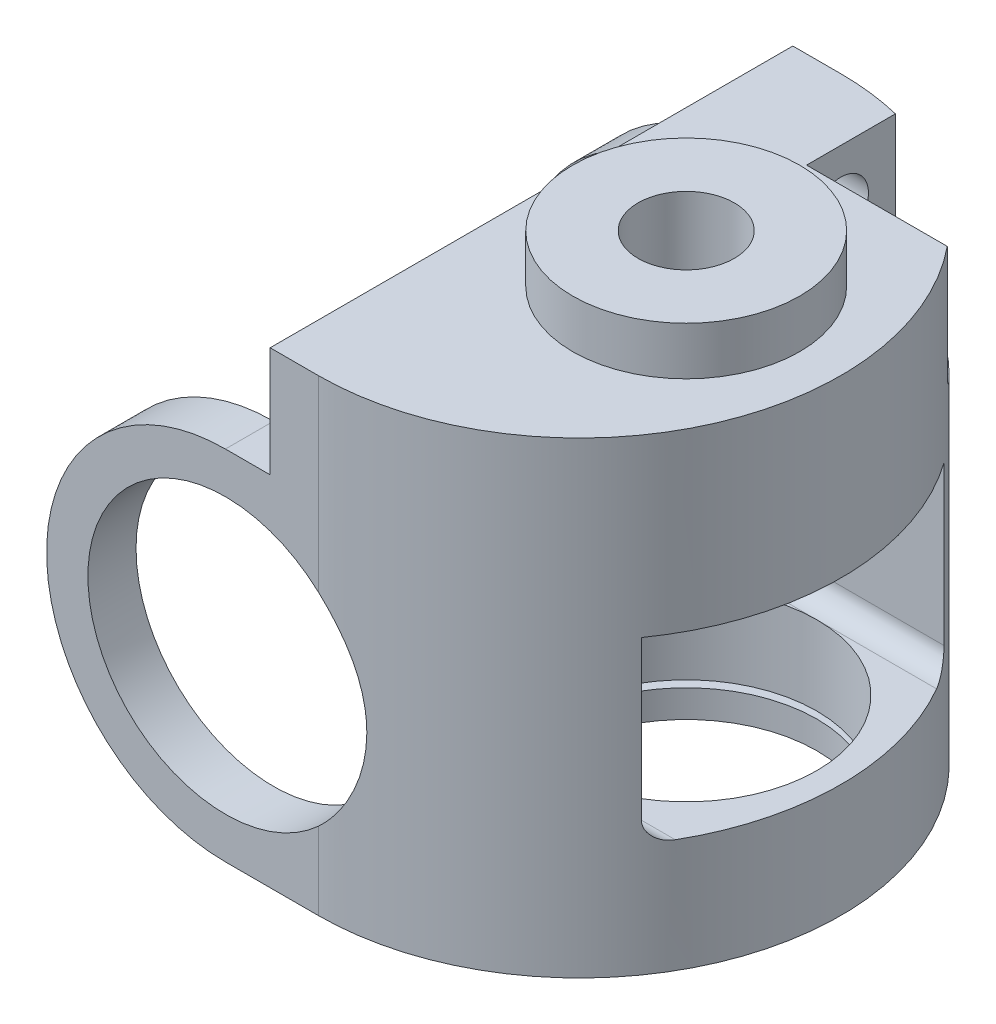
from build123d import *

# Parameters (mm, degrees)
SKETCH2_R               = 3.5
BOSS_EXTRUDE1_DEPTH     = 34
SKETCH19_R              = 8.25
SKETCH19_R_2            = 3.5
BOSS_EXTRUDE3_DEPTH     = 3.5
BOSS_EXTRUDE2_DEPTH     = 3.5
SKETCH4_R               = 10
CUT_EXTRUDE1_DEPTH      = 3.5
LPATTERN4_COUNT         = 2
LPATTERN4_PITCH         = 34.5
CUT_EXTRUDE3_DEPTH      = 48.681233293
SKETCH7_R               = 13.5
CUT_EXTRUDE4_DEPTH      = 4.5
LPATTERN3_COUNT         = 2
LPATTERN3_PITCH         = 26.5
M2_TAPPED_HOLE1_D       = 1.6
M2_TAPPED_HOLE1_DEPTH   = 5.5
M2_TAPPED_HOLE1_TIP     = 0.480688495
SKETCH17_R              = 2
CUT_EXTRUDE5_DEPTH      = 8
CUT_EXTRUDE6_REACH      = 50.532
CUT_EXTRUDE6_END_RADIUS = 19
SKETCH20_R              = 9.75
CUT_EXTRUDE7_DEPTH      = 6.25
SKETCH21_R              = 8.5
CUT_EXTRUDE8_DEPTH      = 0.5
SKETCH22_R              = 9.5
CUT_EXTRUDE9_DEPTH      = 5.75
SKETCH23_R              = 10.5
CUT_EXTRUDE10_DEPTH     = 0.5
SKETCH24_R              = 9.5
CUT_EXTRUDE11_DEPTH     = 2


with BuildPart() as part:
    # Sketch2 → Boss-Extrude1 (new body)
    with BuildSketch(Plane(origin=(0, 0, 0), x_dir=(1, 0, 0), z_dir=(0, 1, 0))):
        with BuildLine():
            Line((-3.5, -19), (-3.5, 19))
            Line((-3.5, 19), (0, 19))
            ThreePointArc((0, 19), (19, 0), (0, -19))
            Line((0, -19), (-3.5, -19))
        make_face()
        with Locations(Location((7.75, 0, 0), (0, 0, 270))):
            Circle(SKETCH2_R, mode=Mode.SUBTRACT)
    extrude(amount=BOSS_EXTRUDE1_DEPTH)

    # Sketch19 → Boss-Extrude3 (add)
    with BuildSketch(Plane(origin=(0, 34, 0), x_dir=(1, 0, 0), z_dir=(0, 1, 0))):
        with Locations(Location((7.75, 0, 0), (0, 0, 270))):
            Circle(SKETCH19_R)
        with Locations(Location((7.75, 0, 0), (0, 0, 270))):
            Circle(SKETCH19_R_2, mode=Mode.SUBTRACT)
    extrude(amount=BOSS_EXTRUDE3_DEPTH)

    # Sketch3 → Boss-Extrude2 (add)
    with BuildSketch(Plane.XY.offset(19)):
        with BuildLine():
            Line((-6.75, 0), (-3.5, 0))
            Line((-3.5, 0), (-3.5, 26))
            Line((-3.5, 26), (-6.75, 26))
            ThreePointArc((-6.75, 26), (-19.75, 13), (-6.75, 0))
        make_face()
    boss_extrude2 = extrude(amount=-BOSS_EXTRUDE2_DEPTH)

    # Sketch4 → Cut-Extrude1 (cut)
    with BuildSketch(Plane.XY.offset(19)):
        with Locations(Location((-6.75, 13, 0), (0, 0, 312.454150204))):
            Circle(SKETCH4_R)
    cut_extrude1 = extrude(amount=-CUT_EXTRUDE1_DEPTH, mode=Mode.SUBTRACT)

    # LPattern4: Boss-Extrude2, Cut-Extrude1 ×2
    with Locations(*[(0, 0, -i * LPATTERN4_PITCH) for i in range(1, LPATTERN4_COUNT)]):
        add(boss_extrude2)
        add(cut_extrude1, mode=Mode.SUBTRACT)

    # Sketch6 → Cut-Extrude3 (cut, through all)
    with BuildSketch(Plane(origin=(-3.5, 0, 0), x_dir=(0, 0, -1), z_dir=(1, 0, 0))):
        with BuildLine():
            Line((11, 21.25), (-11, 21.25))
            Line((-11, 21.25), (-11, 9.75))
            ThreePointArc((-11, 9.75), (-10.560660172, 8.689339828), (-9.5, 8.25))
            Line((-9.5, 8.25), (9.5, 8.25))
            ThreePointArc((9.5, 8.25), (10.560660172, 8.689339828), (11, 9.75))
            Line((11, 9.75), (11, 21.25))
        make_face()
    extrude(amount=CUT_EXTRUDE3_DEPTH, mode=Mode.SUBTRACT)

    # Sketch7 → Cut-Extrude4 (cut)
    with BuildSketch(Plane(origin=(0, 0, 15.5), x_dir=(-1, 0, 0), z_dir=(0, 0, -1))):
        with Locations((6.75, 13)):
            Circle(SKETCH7_R)
    cut_extrude4 = extrude(amount=CUT_EXTRUDE4_DEPTH, mode=Mode.SUBTRACT)

    # LPattern3: Cut-Extrude4 ×2
    with Locations(*[(0, 0, -i * LPATTERN3_PITCH) for i in range(1, LPATTERN3_COUNT)]):
        add(cut_extrude4, mode=Mode.SUBTRACT)

    # M2 Tapped Hole1
    with Locations(Plane.ZY.offset(3.5)):
        with Locations((11, 31.5)):
            Hole(M2_TAPPED_HOLE1_D / 2, depth=M2_TAPPED_HOLE1_DEPTH)
            with Locations((0, 0, -(M2_TAPPED_HOLE1_DEPTH + M2_TAPPED_HOLE1_TIP / 2))):  # 118° drill point
                Cone(0, M2_TAPPED_HOLE1_D / 2, M2_TAPPED_HOLE1_TIP, mode=Mode.SUBTRACT)

    # Sketch17 → Cut-Extrude5 (cut)
    with BuildSketch(Plane.ZY.offset(3.5)):
        with Locations((-14.5, 30)):
            Circle(SKETCH17_R)
    extrude(amount=-CUT_EXTRUDE5_DEPTH, mode=Mode.SUBTRACT)

    # Cut-Extrude6: up to this cylinder (the profile starts inside it)
    cut_extrude6_end = Plane(origin=(0, 29.282291, 0), z_dir=(0, -1, 0)) * Cylinder(CUT_EXTRUDE6_END_RADIUS, 140.064, mode=Mode.PRIVATE)
    # Sketch18 → Cut-Extrude6 (cut, up to the surface)
    with BuildSketch(Plane.ZY.offset(-4.5), mode=Mode.PRIVATE) as cut_extrude6_sk1:
        with BuildLine():
            Line((-19, 24.5), (-13.5, 24.5))
            ThreePointArc((-13.5, 24.5), (-12.439339828, 24.939339828), (-12, 26))
            Line((-12, 26), (-12, 34))
            Line((-12, 34), (-19, 34))
            Line((-19, 34), (-19, 24.5))
        make_face()
    cut_extrude6_tool1 = extrude(cut_extrude6_sk1.sketch, amount=-CUT_EXTRUDE6_REACH, mode=Mode.PRIVATE) & cut_extrude6_end
    add(cut_extrude6_tool1.solids().sort_by_distance((4.5, 29.282291, -15.523149))[0], mode=Mode.SUBTRACT)

    # Sketch20 → Cut-Extrude7 (cut)
    with BuildSketch(Plane.XZ.offset(-21.25)):
        with Locations(Location((7.75, 0, 0), (0, 0, 270))):
            Circle(SKETCH20_R)
    extrude(amount=-CUT_EXTRUDE7_DEPTH, mode=Mode.SUBTRACT)

    # Sketch21 → Cut-Extrude8 (cut)
    with BuildSketch(Plane.XZ.offset(-27.5)):
        with Locations(Location((7.75, 0, 0), (0, 0, 270))):
            Circle(SKETCH21_R)
    extrude(amount=-CUT_EXTRUDE8_DEPTH, mode=Mode.SUBTRACT)

    # Sketch22 → Cut-Extrude9 (cut)
    with BuildSketch(Plane(origin=(0, 8.25, 0), x_dir=(1, 0, 0), z_dir=(0, 1, 0))):
        with Locations(Location((7.75, 0, 0), (0, 0, 270))):
            Circle(SKETCH22_R)
    extrude(amount=-CUT_EXTRUDE9_DEPTH, mode=Mode.SUBTRACT)

    # Sketch23 → Cut-Extrude10 (cut)
    with BuildSketch(Plane(origin=(0, 2.5, 0), x_dir=(1, 0, 0), z_dir=(0, 1, 0))):
        with Locations(Location((7.75, 0, 0), (0, 0, 270))):
            Circle(SKETCH23_R)
    extrude(amount=-CUT_EXTRUDE10_DEPTH, mode=Mode.SUBTRACT)

    # Sketch24 → Cut-Extrude11 (cut)
    with BuildSketch(Plane(origin=(0, 2, 0), x_dir=(1, 0, 0), z_dir=(0, 1, 0))):
        with Locations(Location((7.75, 0, 0), (0, 0, 270))):
            Circle(SKETCH24_R)
    extrude(amount=-CUT_EXTRUDE11_DEPTH, mode=Mode.SUBTRACT)


solid = part.part
